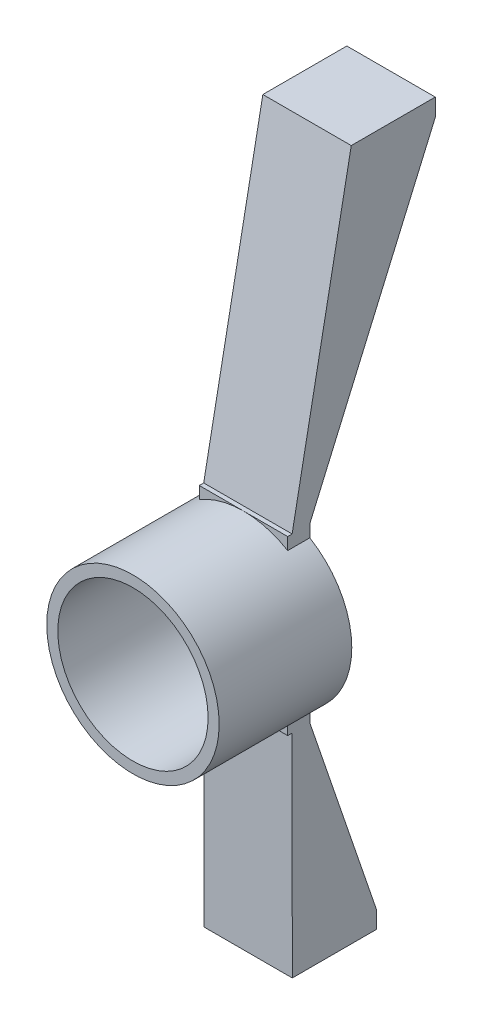
from build123d import *

# Parameters (mm, degrees)
SKETCH2_R           = 39
SKETCH2_R_2         = 34
BOSS_EXTRUDE1_DEPTH = 60
BOSS_EXTRUDE2_DEPTH = 20
BOSS_EXTRUDE3_DEPTH = 10
BOSS_EXTRUDE4_DEPTH = 20
BOSS_EXTRUDE5_DEPTH = 10
BOSS_EXTRUDE6_DEPTH = 8
BOSS_EXTRUDE7_DEPTH = 8
BOSS_EXTRUDE8_DEPTH = 8
BOSS_EXTRUDE9_DEPTH = 8


with BuildPart() as part:
    # Sketch2 → Boss-Extrude1 (new body)
    with BuildSketch(Plane.XY):
        Circle(SKETCH2_R)
        Circle(SKETCH2_R_2, mode=Mode.SUBTRACT)
    extrude(amount=BOSS_EXTRUDE1_DEPTH)



with BuildPart() as body_2:
    # Sketch4 → Boss-Extrude2 (new, symmetric)
    with BuildSketch(Plane(origin=(0, 0, 0), x_dir=(0, 0, -1), z_dir=(1, 0, 0))):
        Polygon((-8, 39), (18.753791407, 177.8), (56.753791407, 177.8), (56.753791407, 169.8), (25.211786138, 169.8), (0, 39), align=None)
    extrude(amount=BOSS_EXTRUDE2_DEPTH, both=True)


with BuildPart() as part_1:
    add(part.part)

    add(body_2.part)  # Boss-Extrude3 merges body 2
    # Sketch5 → Boss-Extrude3 (add)
    with BuildSketch(Plane(origin=(0, 0, 0), x_dir=(-1, 0, 0), z_dir=(0, 0, -1))):
        with BuildLine():
            Line((0, 39), (-20, 39))
            Line((-20, 39), (-20, 33.481338086))
            ThreePointArc((-20, 33.481338086), (-10.373712322, 37.595027499), (0, 39))
        make_face()
        with BuildLine():
            Line((20, 39), (0, 39))
            ThreePointArc((0, 39), (10.373712322, 37.595027499), (20, 33.481338086))
            Line((20, 33.481338086), (20, 39))
        make_face()
    extrude(amount=-BOSS_EXTRUDE3_DEPTH)



with BuildPart() as body_2_2:
    # Sketch7 → Boss-Extrude4 (new, symmetric)
    with BuildSketch(Plane(origin=(0, 0, 0), x_dir=(0, 0, -1), z_dir=(1, 0, 0))):
        Polygon((-8, -39), (-7.916224207, -134.999963446), (30.083775793, -134.999963446), (30.092153418, -127), (0.092153418, -127), (0, -39), align=None)
    extrude(amount=BOSS_EXTRUDE4_DEPTH, both=True)


with BuildPart() as part_2:
    add(part_1.part)

    add(body_2_2.part)  # Boss-Extrude5 merges body 2 2
    # Sketch8 → Boss-Extrude5 (add)
    with BuildSketch(Plane(origin=(0, 0, 0), x_dir=(-1, 0, 0), z_dir=(0, 0, -1))):
        with BuildLine():
            Line((-20, -33.481338086), (-20, -39))
            Line((-20, -39), (0, -39))
            ThreePointArc((0, -39), (-10.373712322, -37.595027499), (-20, -33.481338086))
        make_face()
        with BuildLine():
            ThreePointArc((20, -33.481338086), (10.373712322, -37.595027499), (0, -39))
            Line((0, -39), (20, -39))
            Line((20, -39), (20, -33.481338086))
        make_face()
    extrude(amount=-BOSS_EXTRUDE5_DEPTH)

    # Sketch9 → Boss-Extrude6 (add)
    with BuildSketch(Plane(origin=(20, 0, 0), x_dir=(0, 0, -1), z_dir=(1, 0, 0))):
        Polygon((56.753791407, 169.8), (0, 39), (25.211786138, 169.8), align=None)
    extrude(amount=-BOSS_EXTRUDE6_DEPTH)

    # Sketch10 → Boss-Extrude7 (add)
    with BuildSketch(Plane.ZY.offset(20)):
        Polygon((0, 39), (-25.211786138, 169.8), (-56.753791407, 169.8), align=None)
    extrude(amount=-BOSS_EXTRUDE7_DEPTH)

    # Sketch11 → Boss-Extrude8 (add)
    with BuildSketch(Plane(origin=(20, 0, 0), x_dir=(0, 0, -1), z_dir=(1, 0, 0))):
        Polygon((0, -39), (30.092153418, -127), (0.092153418, -127), align=None)
    extrude(amount=-BOSS_EXTRUDE8_DEPTH)

    # Sketch12 → Boss-Extrude9 (add)
    with BuildSketch(Plane.ZY.offset(20)):
        Polygon((-30.092153418, -127), (-0.092153418, -127), (0, -39), align=None)
    extrude(amount=-BOSS_EXTRUDE9_DEPTH)


solid = part_2.part
